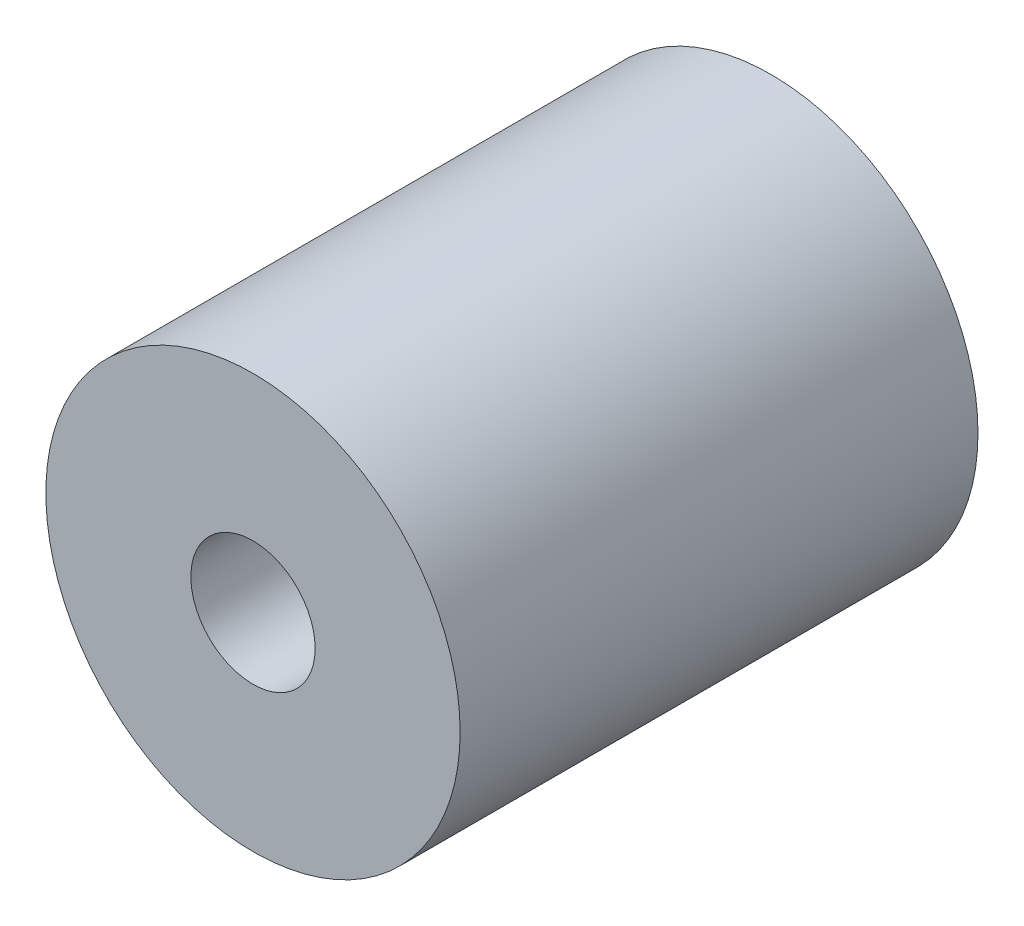
from build123d import *

# Parameters (mm, degrees)
SKETCH1_R           = 10
BOSS_EXTRUDE1_DEPTH = 25
SKETCH2_R           = 3
CUT_EXTRUDE1_DEPTH  = 12
SKETCH3_R           = 4
CUT_EXTRUDE2_DEPTH  = 12


with BuildPart() as part:
    # Sketch1 → Boss-Extrude1 (new body)
    with BuildSketch(Plane.XY):
        Circle(SKETCH1_R)
    extrude(amount=BOSS_EXTRUDE1_DEPTH)

    # Sketch2 → Cut-Extrude1 (cut)
    with BuildSketch(Plane.XY.offset(25)):
        Circle(SKETCH2_R)
    extrude(amount=-CUT_EXTRUDE1_DEPTH, mode=Mode.SUBTRACT)

    # Sketch3 → Cut-Extrude2 (cut)
    with BuildSketch(Plane(origin=(0, 0, 0), x_dir=(-1, 0, 0), z_dir=(0, 0, -1))):
        Circle(SKETCH3_R)
    extrude(amount=-CUT_EXTRUDE2_DEPTH, mode=Mode.SUBTRACT)


solid = part.part
